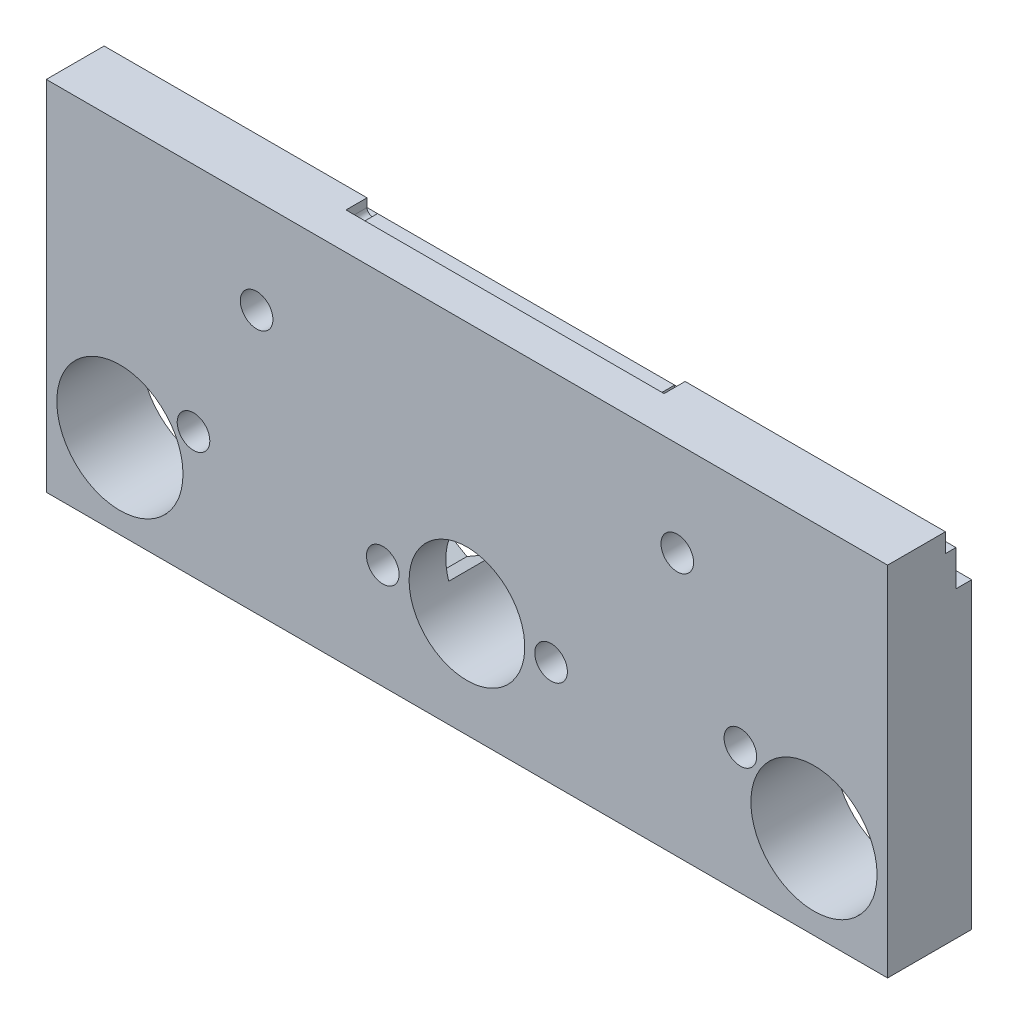
from build123d import *

# Parameters (mm, degrees)
SKETCH_2_W           = 80
SKETCH_2_H           = 34
SKETCH_2_R           = 6
SKETCH_2_R_2         = 4.05
EXTRUDE_1_DEPTH      = 8
CUT_EXTRUDE_2_DEPTH  = 88.292611371
SKETCH_5_R           = 1.55
CUT_EXTRUDE_3_DEPTH  = 88.292611371
CUT_EXTRUDE_5_DEPTH  = 4.5
SKETCH_11_R          = 1.55
CUT_EXTRUDE_7_DEPTH  = 88.292611371
CUT_EXTRUDE_11_DEPTH = 2
SKETCH_22_R          = 1.55
CUT_EXTRUDE_13_DEPTH = 88.292611371
SKETCH_20_R          = 5.5
CUT_EXTRUDE_14_DEPTH = 88.292611371


with BuildPart() as part:
    # 草图2 → 凸台-拉伸1 (new body)
    with BuildSketch(Plane.XY):
        with Locations((40, 17)):
            Rectangle(SKETCH_2_W, SKETCH_2_H)
        with Locations((7, 8)):
            Circle(SKETCH_2_R, mode=Mode.SUBTRACT)
        with Locations((40, 10)):
            Circle(SKETCH_2_R_2, mode=Mode.SUBTRACT)
        with Locations((73, 8)):
            Circle(SKETCH_2_R, mode=Mode.SUBTRACT)
    extrude(amount=EXTRUDE_1_DEPTH)

    # 草图4 → 切除-拉伸2 (cut, through all)
    with BuildSketch(Plane(origin=(80, 0, 0), x_dir=(0, 0, -1), z_dir=(1, 0, 0))):
        Polygon((-1.5, 32.2), (-2.5, 32.2), (-2.5, 34), (0, 34), (0, 28.8), (-1.5, 28.8), align=None)
    extrude(amount=-CUT_EXTRUDE_2_DEPTH, mode=Mode.SUBTRACT)

    # 草图5 → 切除-拉伸3 (cut, through all)
    with BuildSketch(Plane.XY.offset(8)):
        with Locations((48, 10)):
            Circle(SKETCH_5_R)
        with Locations((32, 10)):
            Circle(SKETCH_5_R)
    extrude(amount=-CUT_EXTRUDE_3_DEPTH, mode=Mode.SUBTRACT)

    # 草图8 → 切除-拉伸5 (cut)
    with BuildSketch(Plane(origin=(0, 0, 0), x_dir=(-1, 0, 0), z_dir=(0, 0, -1))):
        Polygon((-45.15, 8.354551733), (-45.15, 11.645448267), (-48, 13.290896534), (-50.85, 11.645448267), (-50.85, 8.354551733), (-48, 6.709103466), align=None)
        Polygon((-34.85, 8.354551733), (-32, 6.709103466), (-29.15, 8.354551733), (-29.15, 11.645448267), (-32, 13.290896534), (-34.85, 11.645448267), align=None)
    extrude(amount=-CUT_EXTRUDE_5_DEPTH, mode=Mode.SUBTRACT)

    # 草图11 → 切除-拉伸7 (cut, through all)
    with BuildSketch(Plane(origin=(0, 0, 0), x_dir=(-1, 0, 0), z_dir=(0, 0, -1))):
        with Locations((-60, 25)):
            Circle(SKETCH_11_R)
        with Locations((-20, 25)):
            Circle(SKETCH_11_R)
    extrude(amount=-CUT_EXTRUDE_7_DEPTH, mode=Mode.SUBTRACT)

    # 草图19 → 切除-拉伸11 (cut)
    with BuildSketch(Plane(origin=(0, 0, 2.5), x_dir=(-1, 0, 0), z_dir=(0, 0, -1))):
        with BuildLine():
            Line((-25, 34), (-55.247938178, 34))
            Line((-55.247938178, 34), (-55.247938178, 33.2))
            ThreePointArc((-55.247938178, 33.2), (-54.747938178, 32.7), (-54.247938178, 33.2))
            Line((-54.247938178, 33.2), (-26, 33.2))
            ThreePointArc((-26, 33.2), (-25.5, 32.7), (-25, 33.2))
            Line((-25, 33.2), (-25, 34))
        make_face()
    extrude(amount=-CUT_EXTRUDE_11_DEPTH, mode=Mode.SUBTRACT)

    # 草图22 → 切除-拉伸13 (cut, through all)
    with BuildSketch(Plane(origin=(0, 0, 0), x_dir=(-1, 0, 0), z_dir=(0, 0, -1))):
        with Locations((-66, 12)):
            Circle(SKETCH_22_R)
        with Locations(Location((-14, 12, 0), (0, 0, 180))):
            Circle(SKETCH_22_R)
    extrude(amount=-CUT_EXTRUDE_13_DEPTH, mode=Mode.SUBTRACT)

    # 草图20 → 切除-拉伸14 (cut, through all)
    with BuildSketch(Plane(origin=(0, 0, 0), x_dir=(-1, 0, 0), z_dir=(0, 0, -1))):
        with Locations((-40, 10)):
            Circle(SKETCH_20_R)
    extrude(amount=-CUT_EXTRUDE_14_DEPTH, mode=Mode.SUBTRACT)


solid = part.part
